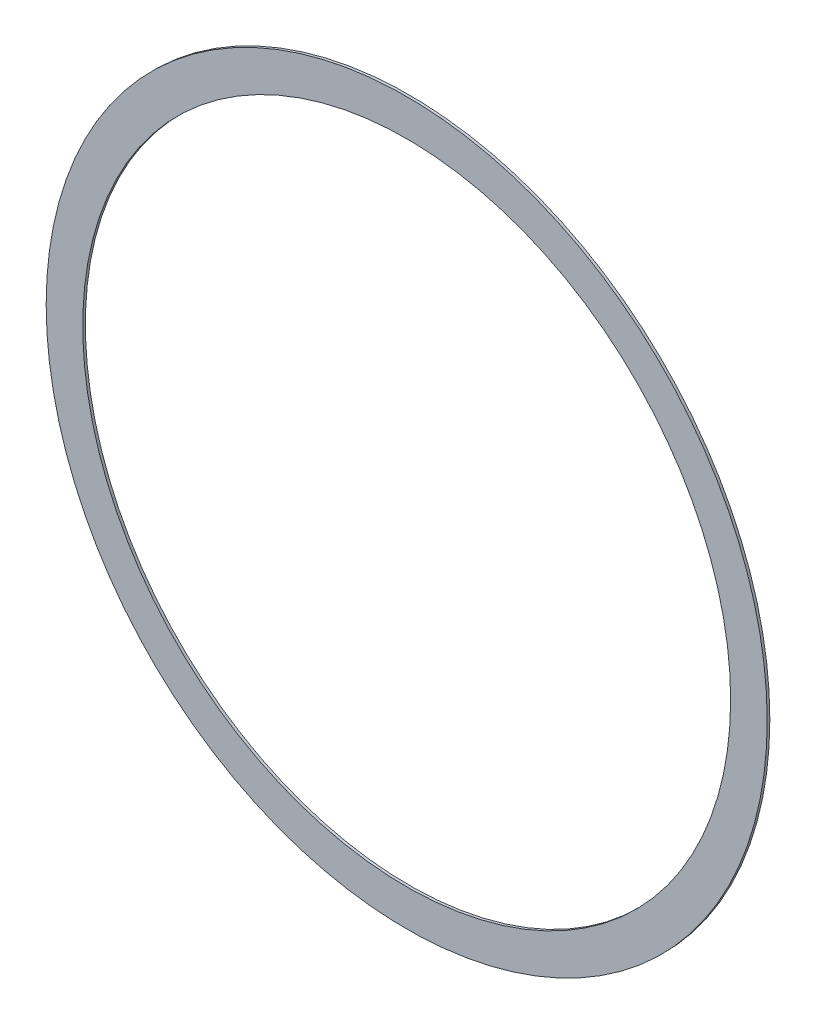
from build123d import *

# Parameters (mm, degrees)
SKETCH1_R           = 69
SKETCH1_R_2         = 62
BOSS_EXTRUDE1_DEPTH = 0.5


with BuildPart() as part:
    # Sketch1 → Boss-Extrude1 (new body)
    with BuildSketch(Plane.XY):
        Circle(SKETCH1_R)
        Circle(SKETCH1_R_2, mode=Mode.SUBTRACT)
    extrude(amount=BOSS_EXTRUDE1_DEPTH)


solid = part.part
